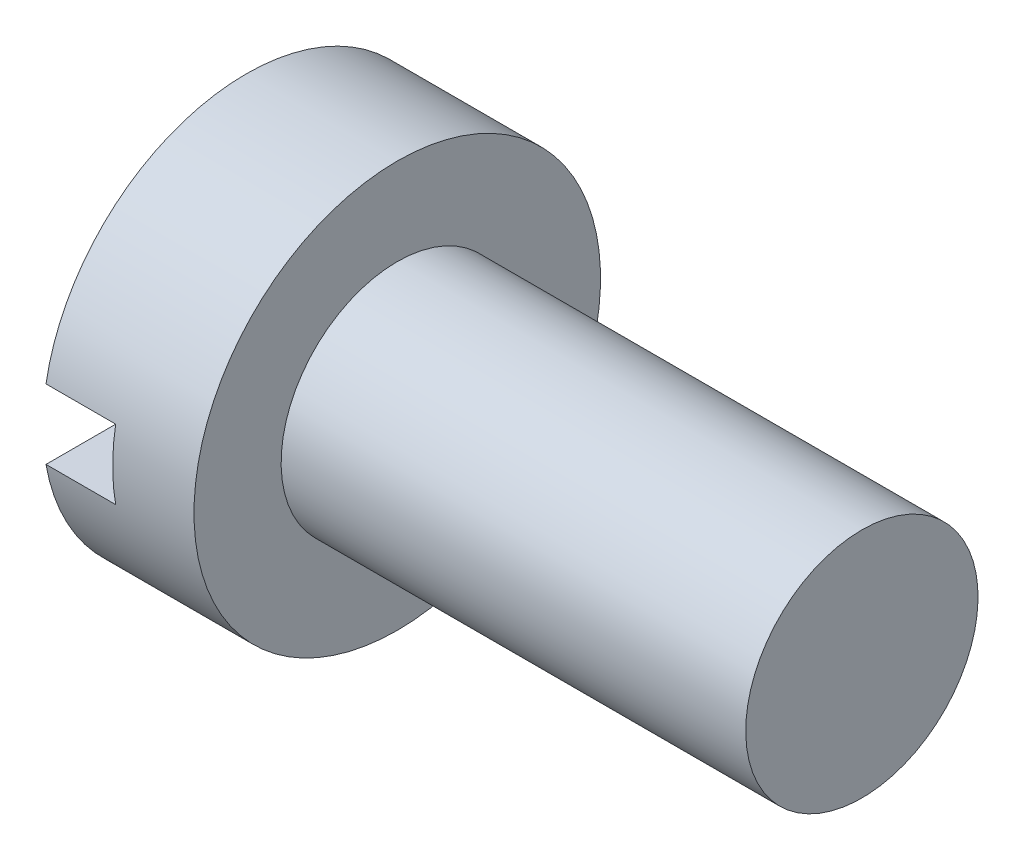
from build123d import *

# Parameters (mm, degrees)
SKETCH2_W          = 7
SKETCH2_H          = 1.2
CUT_EXTRUDE1_DEPTH = 1.2


with BuildPart() as part:
    # Sketch1 → Revolve1 (revolve)
    with BuildSketch(Plane.XY):
        Polygon((0, 0), (0, 3.5), (2.6, 3.5), (2.6, 2), (10.6, 2), (10.6, 0), align=None)
    revolve(axis=Axis((10.6, 0, 0), (-1, 0, 0)))

    # Sketch2 → Cut-Extrude1 (cut)
    with BuildSketch(Plane.ZY):
        Rectangle(SKETCH2_W, SKETCH2_H)
    extrude(amount=-CUT_EXTRUDE1_DEPTH, mode=Mode.SUBTRACT)


solid = part.part
